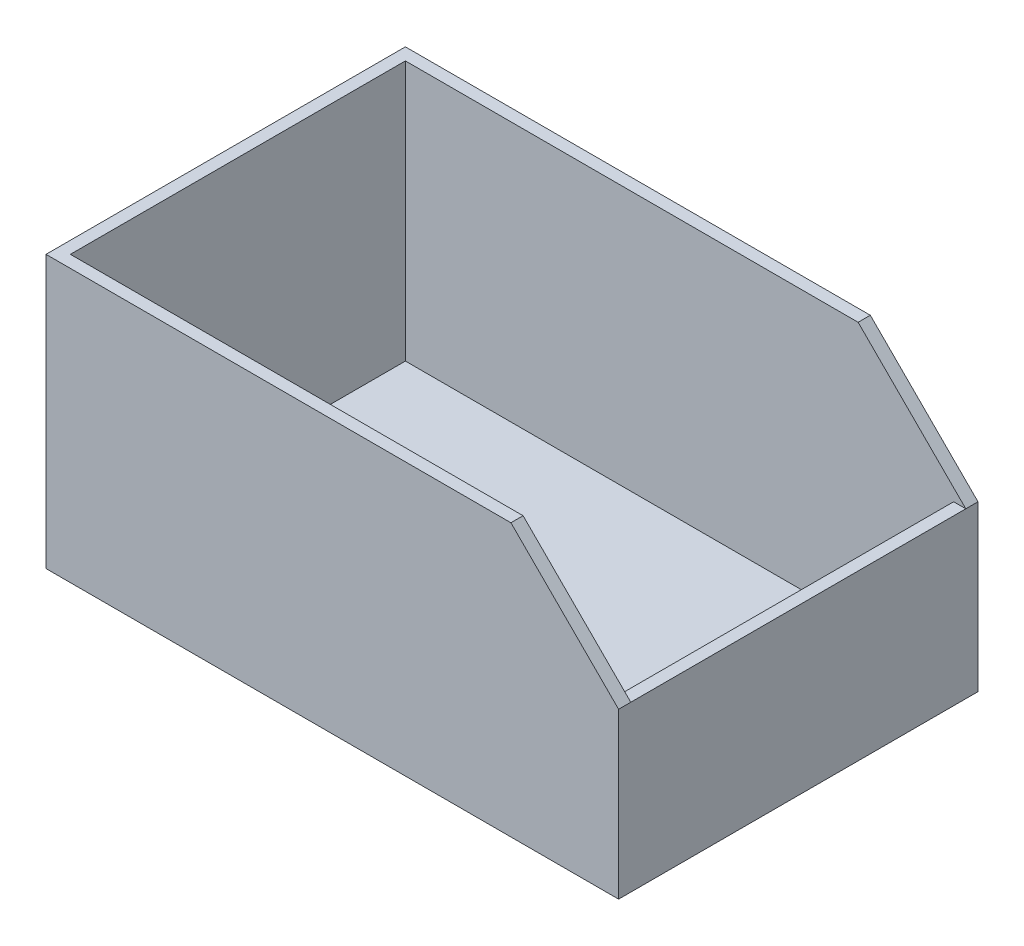
from build123d import *

# Parameters (mm, degrees)
SKETCH1_W           = 180
SKETCH1_H           = 110
BOSS_EXTRUDE1_DEPTH = 4
SKETCH3_W           = 110
SKETCH3_H           = 54
BOSS_EXTRUDE2_DEPTH = 4
BOSS_EXTRUDE3_DEPTH = 4
SKETCH5_W           = 114
SKETCH5_H           = 89.355339059
BOSS_EXTRUDE4_DEPTH = 4
BOSS_EXTRUDE5_DEPTH = 4


with BuildPart() as part:
    # Sketch1 → Boss-Extrude1 (new body)
    with BuildSketch(Plane(origin=(0, 0, 0), x_dir=(1, 0, 0), z_dir=(0, 1, 0))):
        with Locations((90, 55)):
            Rectangle(SKETCH1_W, SKETCH1_H)
    extrude(amount=BOSS_EXTRUDE1_DEPTH)

    # Sketch3 → Boss-Extrude2 (add)
    with BuildSketch(Plane(origin=(180, 0, 0), x_dir=(0, 0, -1), z_dir=(1, 0, 0))):
        with Locations((55, 27)):
            Rectangle(SKETCH3_W, SKETCH3_H)
    extrude(amount=BOSS_EXTRUDE2_DEPTH)

    # Sketch4 → Boss-Extrude3 (add)
    with BuildSketch(Plane(origin=(0, 0, -110), x_dir=(-1, 0, 0), z_dir=(0, 0, -1))):
        Polygon((-184, 54), (-148.644660941, 89.355339059), (0, 89.355339059), (0, 4), (0, 0), (-184, 0), align=None)
    extrude(amount=BOSS_EXTRUDE3_DEPTH)

    # Sketch5 → Boss-Extrude4 (add)
    with BuildSketch(Plane.ZY):
        with Locations((-57, 44.67766953)):
            Rectangle(SKETCH5_W, SKETCH5_H)
    extrude(amount=BOSS_EXTRUDE4_DEPTH)

    # Sketch10 → Boss-Extrude5 (add)
    with BuildSketch(Plane.XY):
        Polygon((-4, 89.355339059), (148.644660941, 89.355339059), (184, 54), (184, 0), (-4, 0), align=None)
    extrude(amount=BOSS_EXTRUDE5_DEPTH)


solid = part.part
